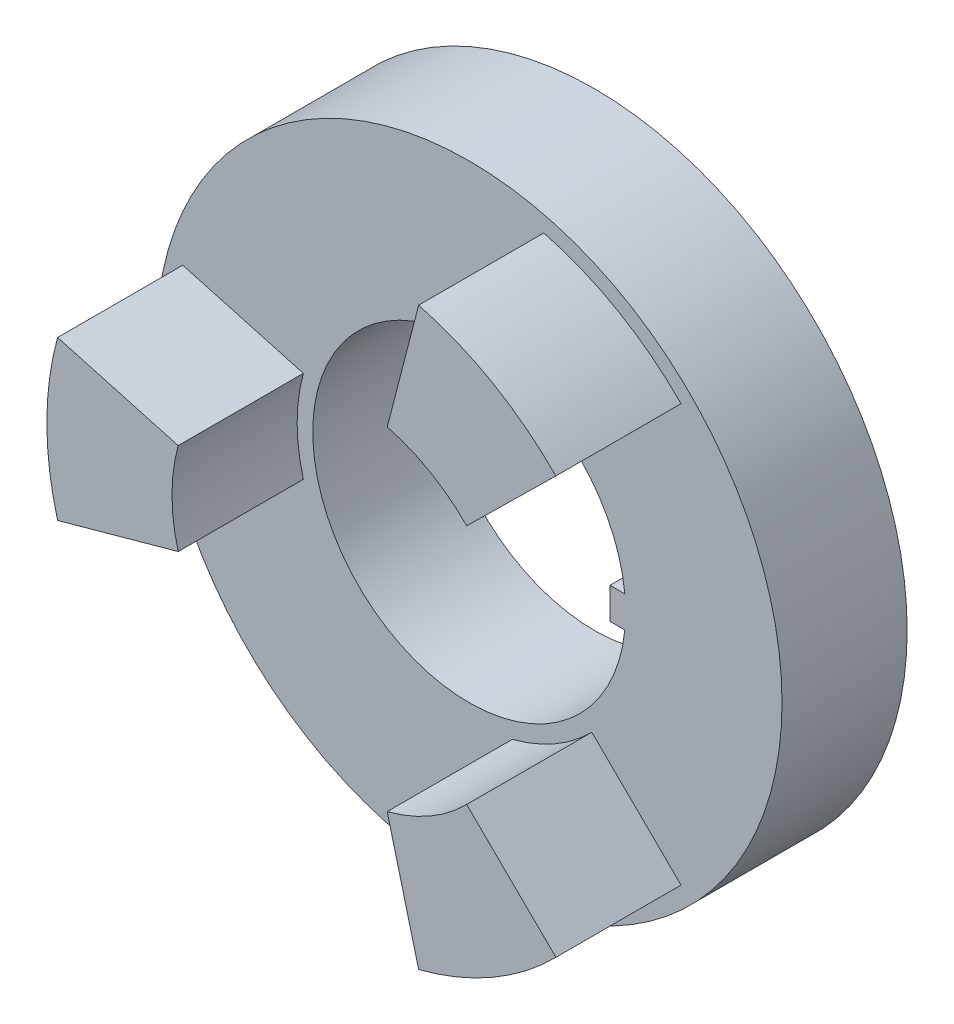
from build123d import *

# Parameters (mm, degrees)
SKETCH1_R           = 10
SKETCH1_R_2         = 5
BOSS_EXTRUDE2_DEPTH = 4
BOSS_EXTRUDE3_DEPTH = 4
SKETCH3_W           = 1
SKETCH3_H           = 1
BOSS_EXTRUDE4_DEPTH = 4


with BuildPart() as part:
    # Sketch1 → Boss-Extrude2 (new body)
    with BuildSketch(Plane.XY):
        Circle(SKETCH1_R)
        Circle(SKETCH1_R_2, mode=Mode.SUBTRACT)
    extrude(amount=BOSS_EXTRUDE2_DEPTH)

    # Sketch2 → Boss-Extrude3 (add)
    with BuildSketch(Plane.XY.offset(4)):
        with BuildLine():
            ThreePointArc((-5.5, 0), (-5.449982192, 0.74006358), (-5.300838508, 1.466666667))
            Line((-5.300838508, 1.466666667), (-9.155993787, 2.533333333))
            ThreePointArc((-9.155993787, 2.533333333), (-9.413605605, 1.278291639), (-9.5, 0))
            ThreePointArc((-9.5, 0), (-9.413605605, -1.278291639), (-9.155993787, -2.533333333))
            Line((-9.155993787, -2.533333333), (-5.300838508, -1.466666667))
            ThreePointArc((-5.300838508, -1.466666667), (-5.449982192, -0.74006358), (-5.5, 0))
        make_face()
        with BuildLine():
            ThreePointArc((3.920589846, -3.857327476), (2.75, -4.763139721), (1.380248662, -5.323994143))
            Line((1.380248662, -5.323994143), (2.38406587, -9.195989883))
            ThreePointArc((2.38406587, -9.195989883), (4.75, -8.227241336), (6.771927916, -6.66265655))
            Line((6.771927916, -6.66265655), (3.920589846, -3.857327476))
        make_face()
        with BuildLine():
            Line((2.38406587, 9.195989883), (1.380248662, 5.323994143))
            ThreePointArc((1.380248662, 5.323994143), (2.75, 4.763139721), (3.920589846, 3.857327476))
            Line((3.920589846, 3.857327476), (6.771927916, 6.66265655))
            ThreePointArc((6.771927916, 6.66265655), (4.75, 8.227241336), (2.38406587, 9.195989883))
        make_face()
    extrude(amount=BOSS_EXTRUDE3_DEPTH)

    # Sketch3 → Boss-Extrude4 (add)
    with BuildSketch(Plane(origin=(0, 0, 0), x_dir=(-1, 0, 0), z_dir=(0, 0, -1))):
        with Locations((-5, 0)):
            Rectangle(SKETCH3_W, SKETCH3_H)
    extrude(amount=-BOSS_EXTRUDE4_DEPTH)


solid = part.part
